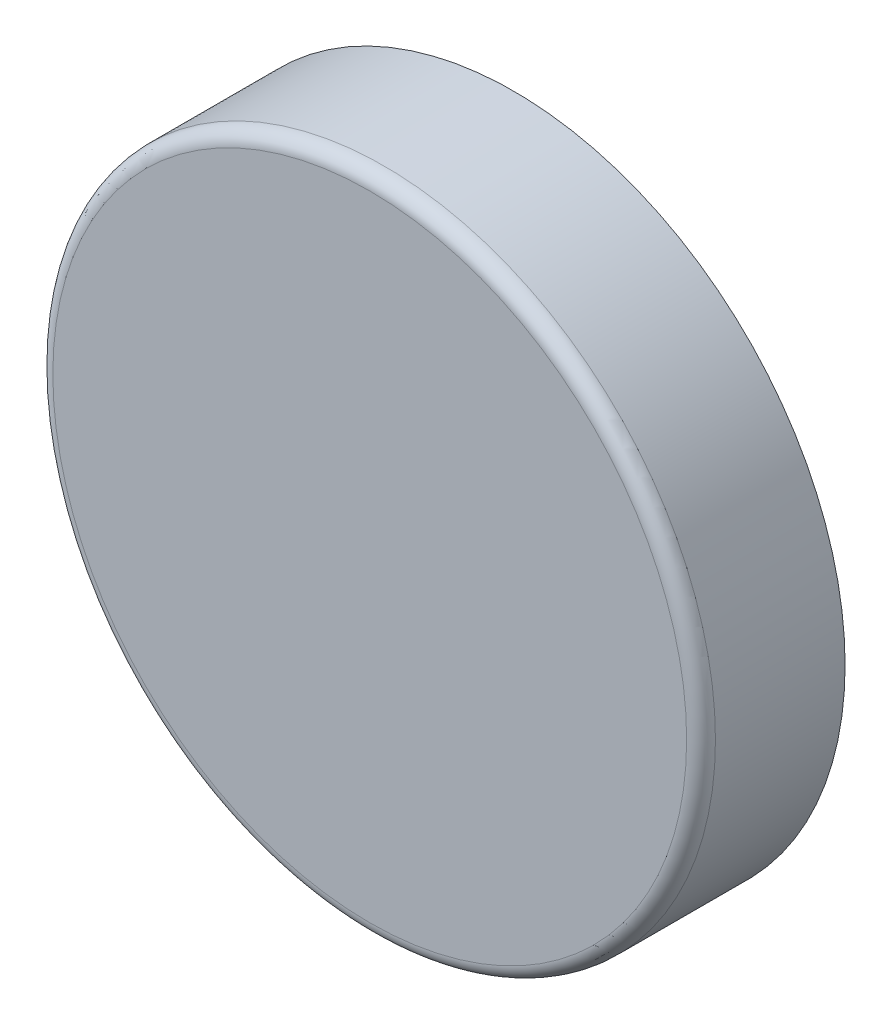
from build123d import *


with BuildPart() as part:
    # 草图1 → 旋转1 (revolve)
    with BuildSketch(Plane.XZ, mode=Mode.PRIVATE) as revolve_1_sk:
        with BuildLine():
            Line((1.65, 5), (-0.55, 5))
            Line((-0.55, 5), (-0.55, 4))
            Line((-0.55, 4), (1.75, 4))
            Line((1.75, 4), (1.75, 4.9))
            ThreePointArc((1.75, 4.9), (1.720710678, 4.970710678), (1.65, 5))
        make_face()
    revolve(revolve_1_sk.sketch.rotate(Axis((-0.55, 0, 5), (0, 0, -1)), 180), axis=Axis((-0.55, 0, 5), (0, 0, -1)))


solid = part.part
